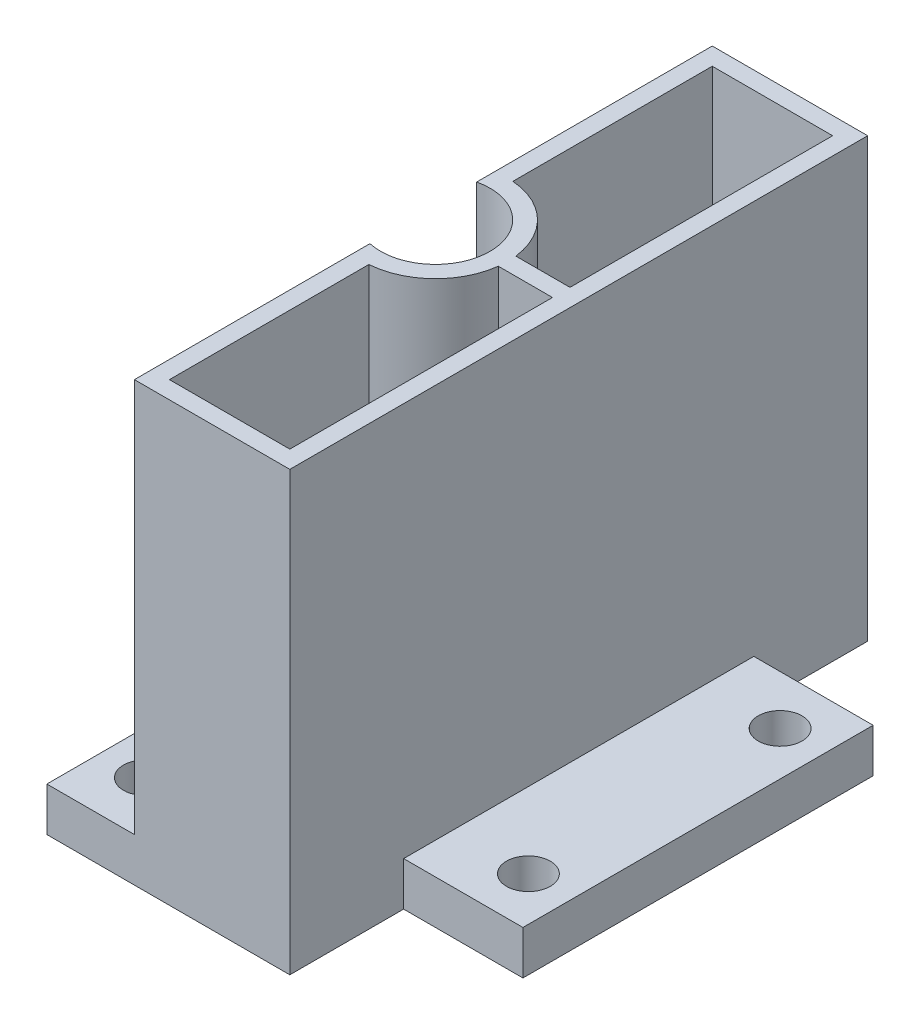
from build123d import *

# Parameters (mm, degrees)
BOSS_EXTRUDE1_DEPTH = 20
SKETCH1_3_W         = 4
SKETCH1_3_H         = 10
SKETCH1_3_R         = 1
SKETCH1_3_W_2       = 5.45
SKETCH1_3_H_2       = 16
BOSS_EXTRUDE2_DEPTH = 2


with BuildPart() as part:
    # Sketch1 → Boss-Extrude1 (new body)
    with BuildSketch(Plane(origin=(0, 0, 0), x_dir=(1, 0, 0), z_dir=(0, 1, 0))):
        with BuildLine():
            ThreePointArc((-0.906603032, 2.43874968), (2.143396968, 0), (-0.906603032, -2.43874968))
            Line((-0.906603032, -2.43874968), (-0.906603032, -13.2))
            Line((-0.906603032, -13.2), (6.193396968, -13.2))
            Line((6.193396968, -13.2), (6.193396968, 13.2))
            Line((6.193396968, 13.2), (-0.906603032, 13.2))
            Line((-0.906603032, 13.2), (-0.906603032, 2.43874968))
        make_face()
        with BuildLine():
            Line((5.393396968, 12.4), (5.393396968, 0.4))
            Line((5.393396968, 0.4), (2.919064839, 0.4))
            ThreePointArc((2.919064839, 0.4), (1.922948491, 2.386135967), (-0.106603032, 3.290516677))
            Line((-0.106603032, 3.290516677), (-0.106603032, 12.4))
            Line((-0.106603032, 12.4), (5.393396968, 12.4))
        make_face(mode=Mode.SUBTRACT)
        with BuildLine():
            Line((-0.106603032, -12.4), (-0.106603032, -3.290516677))
            ThreePointArc((-0.106603032, -3.290516677), (1.922948491, -2.386135967), (2.919064839, -0.4))
            Line((2.919064839, -0.4), (5.393396968, -0.4))
            Line((5.393396968, -0.4), (5.393396968, -12.4))
            Line((5.393396968, -12.4), (-0.106603032, -12.4))
        make_face(mode=Mode.SUBTRACT)
    extrude(amount=BOSS_EXTRUDE1_DEPTH)

    # Sketch1<3> → Boss-Extrude2 (add)
    # profile 1 of 3: a face of its own
    with BuildSketch(Plane(origin=(0, 0, 0), x_dir=(1, 0, 0), z_dir=(0, 1, 0))):
        with Locations((-2.906603032, 8.2)):
            Rectangle(SKETCH1_3_W, SKETCH1_3_H)
        with Locations((-2.906603032, 5.7)):
            Circle(SKETCH1_3_R, mode=Mode.SUBTRACT)
        with Locations((-2.906603032, 10.7)):
            Circle(SKETCH1_3_R, mode=Mode.SUBTRACT)
    # profile 2 of 3: a face of its own
    with BuildSketch(Plane(origin=(0, 0, 0), x_dir=(1, 0, 0), z_dir=(0, 1, 0))):
        with Locations((-2.906603032, -8.2)):
            Rectangle(SKETCH1_3_W, SKETCH1_3_H)
        with Locations((-2.906603032, -10.7)):
            Circle(SKETCH1_3_R, mode=Mode.SUBTRACT)
        with Locations((-2.906603032, -5.7)):
            Circle(SKETCH1_3_R, mode=Mode.SUBTRACT)
    # profile 3 of 3: a face of its own
    with BuildSketch(Plane(origin=(0, 0, 0), x_dir=(1, 0, 0), z_dir=(0, 1, 0))):
        with Locations((8.918396968, 0)):
            Rectangle(SKETCH1_3_W_2, SKETCH1_3_H_2)
        with Locations((9.643396968, -5.75)):
            Circle(SKETCH1_3_R, mode=Mode.SUBTRACT)
        with Locations((9.643396968, 5.75)):
            Circle(SKETCH1_3_R, mode=Mode.SUBTRACT)
    extrude(amount=BOSS_EXTRUDE2_DEPTH)


solid = part.part
